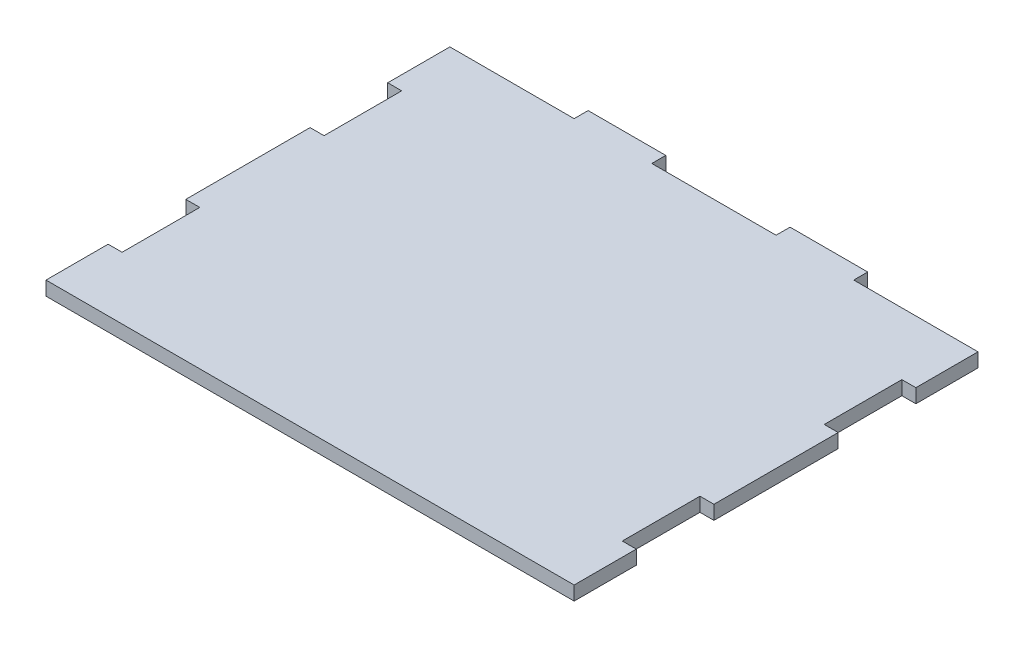
from build123d import *

# Parameters (mm, degrees)
BOSS_EXTRUDE1_DEPTH = 4.5


with BuildPart() as part:
    # Sketch1 → Boss-Extrude1 (new body)
    with BuildSketch(Plane(origin=(0, 0, 0), x_dir=(1, 0, 0), z_dir=(0, 1, 0))):
        Polygon((-91.446629213, 35.695224719), (-51.446629213, 35.695224719), (-51.446629213, 40.195224719), (-26.446629213, 40.195224719), (-26.446629213, 35.695224719), (13.553370787, 35.695224719), (13.553370787, 40.195224719), (38.553370787, 40.195224719), (38.553370787, 35.695224719), (78.553370787, 35.695224719), (78.553370787, 15.695224719), (74.053370787, 15.695224719), (74.053370787, -9.304775281), (78.553370787, -9.304775281), (78.553370787, -49.304775281), (74.053370787, -49.304775281), (74.053370787, -74.304775281), (78.553370787, -74.304775281), (78.553370787, -94.304775281), (-91.446629213, -94.304775281), (-91.446629213, -74.304775281), (-86.946629213, -74.304775281), (-86.946629213, -49.304775281), (-91.446629213, -49.304775281), (-91.446629213, -9.304775281), (-86.946629213, -9.304775281), (-86.946629213, 15.695224719), (-91.446629213, 15.695224719), align=None)
    extrude(amount=BOSS_EXTRUDE1_DEPTH)


solid = part.part
